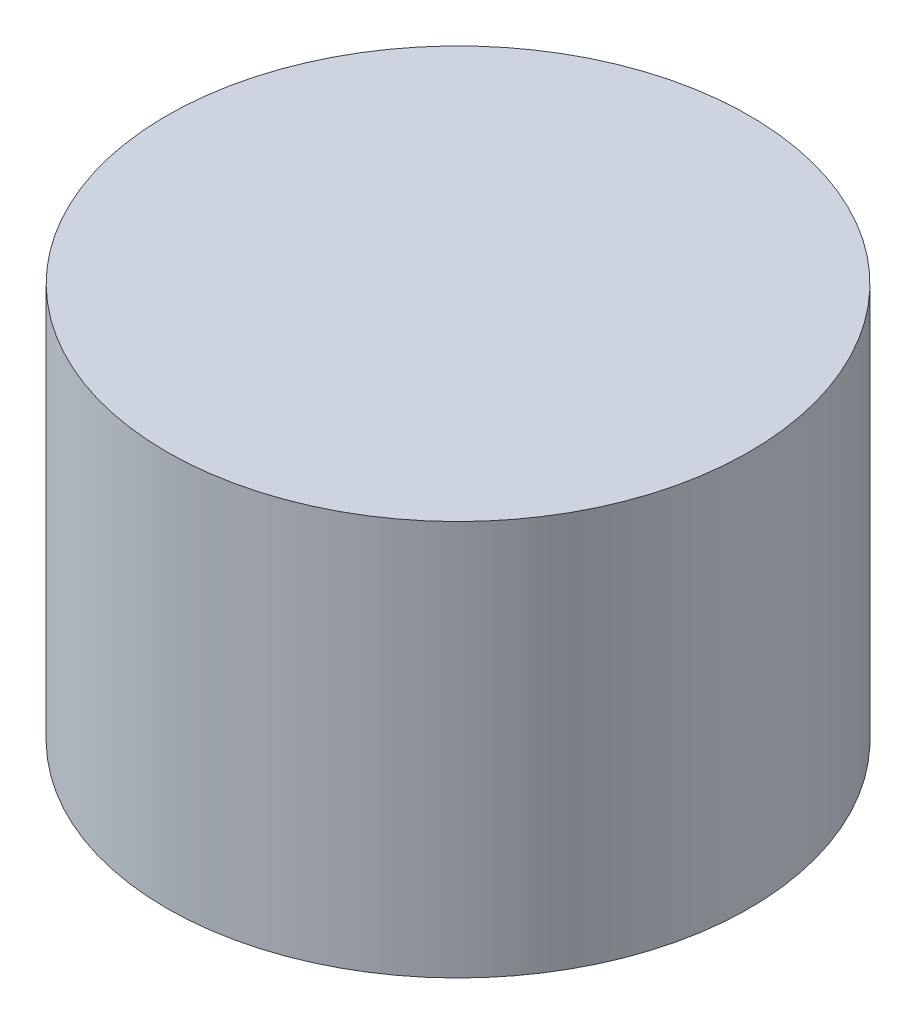
from build123d import *

# Parameters (mm, degrees)
SKETCH_1_R      = 14
EXTRUDE_1_DEPTH = 19


with BuildPart() as part:
    # 草图1 → 凸台-拉伸1 (new body)
    with BuildSketch(Plane(origin=(0, 0, 0), x_dir=(1, 0, 0), z_dir=(0, 1, 0))):
        with Locations(Location((0, 0, 0), (0, 0, 270))):
            Circle(SKETCH_1_R)
    extrude(amount=EXTRUDE_1_DEPTH)


solid = part.part
